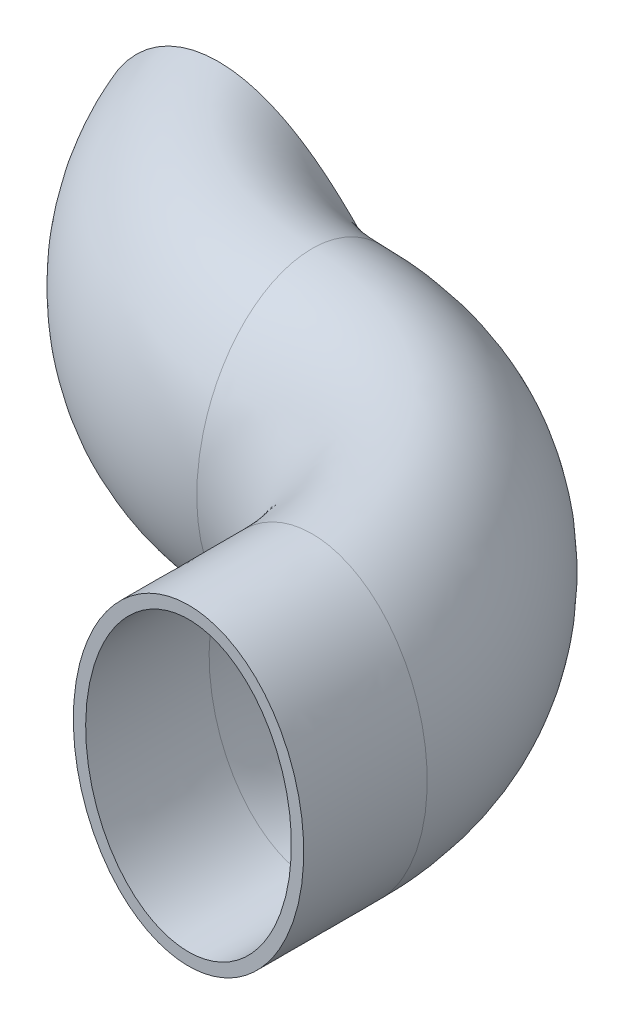
from build123d import *

# Parameters (mm, degrees)
CROQUIS2_RX                = 38
CROQUIS2_RY                = 28
CROQUIS2_RX_2              = 35
CROQUIS2_RY_2              = 25
CORTAR_EXTRUIR1_DEPTH      = 50
CORTAR_EXTRUIR1_DEPTH_BACK = 50
CROQUIS21_W                = 114.739521271
CROQUIS21_H                = 36.181021707


with BuildPart() as part:
    # Barrer6: sweep along a path in Croquis3
    with BuildLine(Plane(origin=(0, 0, 0), x_dir=(1, 0, 0), z_dir=(0, 1, 0))) as barrer6_path:
        Line((0, 0), (0, 30))
        ThreePointArc((0, 30), (-17.573593129, 72.426406871), (-60, 90))
        ThreePointArc((-60, 90), (-102.426406871, 107.573593129), (-120, 150))
    # Croquis2 → Barrer6 (sweep)
    with BuildSketch(Plane.XY):
        with Locations(Location((0, 0), (0, 0, 90))):
            Ellipse(CROQUIS2_RX, CROQUIS2_RY)
        with Locations(Location((0, 0), (0, 0, -90))):
            Ellipse(CROQUIS2_RX_2, CROQUIS2_RY_2, mode=Mode.SUBTRACT)
    sweep(path=barrer6_path.line)

    # Croquis21 → Cortar-Extruir1 (cut, two sides: drawn at the far end of the back side and taken through both)
    with BuildSketch(Plane(origin=(0, 0, 0), x_dir=(1, 0, 0), z_dir=(0, 1, 0)).offset(-CORTAR_EXTRUIR1_DEPTH_BACK)):
        with Locations((-117.369760636, 136.090510854)):
            Rectangle(CROQUIS21_W, CROQUIS21_H)
    extrude(amount=CORTAR_EXTRUIR1_DEPTH + CORTAR_EXTRUIR1_DEPTH_BACK, mode=Mode.SUBTRACT)


solid = part.part
